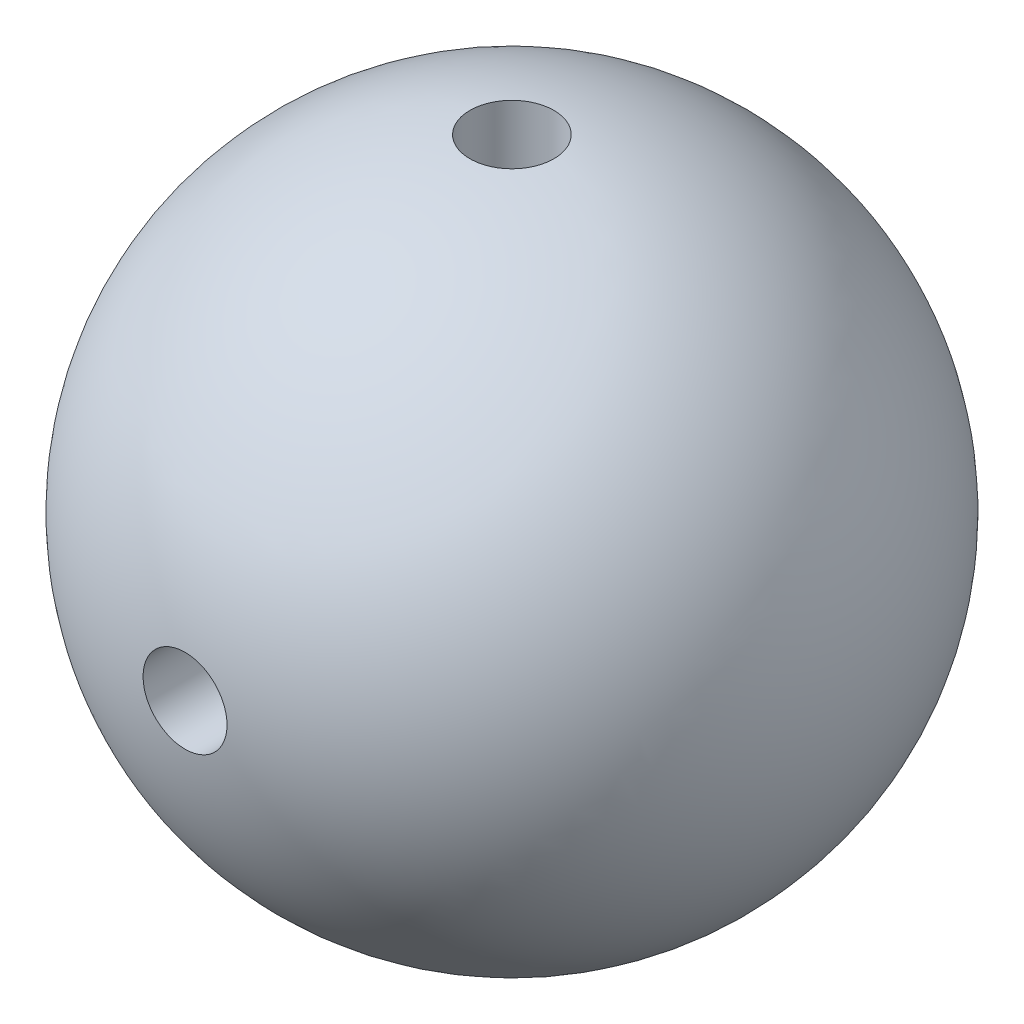
from build123d import *

# Parameters (mm, degrees)
CUT_EXTRUDE3_REACH                  = 15.597
CUT_EXTRUDE3_END_RADIUS             = 7.85
SKETCH3_R                           = 1
CUT_EXTRUDE3_DIRECTION_2_REACH      = 15.597
CUT_EXTRUDE3_DIRECTION_2_END_RADIUS = 7.85
CUT_EXTRUDE4_REACH                  = 15.597
CUT_EXTRUDE4_END_RADIUS             = 7.85
SKETCH4_R                           = 1
CUT_EXTRUDE4_DIRECTION_2_REACH      = 15.597
CUT_EXTRUDE4_DIRECTION_2_END_RADIUS = 7.85


with BuildPart() as part:
    # Sketch2 → Revolve1 (revolve)
    with BuildSketch(Plane(origin=(0, 0, 0), x_dir=(1, 0, 0), z_dir=(0, 1, 0))):
        with BuildLine():
            Line((0, 7.85), (0, -7.85))
            ThreePointArc((0, -7.85), (7.85, 0), (0, 7.85))
        make_face()
    revolve(axis=Axis((0, 0, -7.85), (0, 0, 1)))

    # Cut-Extrude3: up to this sphere (the profile starts inside it)
    cut_extrude3_end = Location((0, 0, 0)) * Sphere(CUT_EXTRUDE3_END_RADIUS, mode=Mode.PRIVATE)
    # Sketch3 → Cut-Extrude3 (cut, up to the surface)
    with BuildSketch(Plane(origin=(0, 0, 0), x_dir=(1, 0, 0), z_dir=(0, 1, 0)), mode=Mode.PRIVATE) as cut_extrude3_sk1:
        with Locations(Location((0, 0, 0), (0, 0, 90))):
            Circle(SKETCH3_R)
    cut_extrude3_tool1 = extrude(cut_extrude3_sk1.sketch, amount=-CUT_EXTRUDE3_REACH, mode=Mode.PRIVATE) & cut_extrude3_end
    add(cut_extrude3_tool1.solids().sort_by_distance((0, 0, 0))[0], mode=Mode.SUBTRACT)

    # Cut-Extrude3 direction 2: up to this sphere (the profile starts inside it)
    cut_extrude3_direction_2_end = Location((0, 0, 0)) * Sphere(CUT_EXTRUDE3_DIRECTION_2_END_RADIUS, mode=Mode.PRIVATE)
    # Sketch3 → Cut-Extrude3 direction 2 (cut, up to the surface)
    with BuildSketch(Plane(origin=(0, 0, 0), x_dir=(1, 0, 0), z_dir=(0, 1, 0)), mode=Mode.PRIVATE) as cut_extrude3_direction_2_sk1:
        with Locations(Location((0, 0, 0), (0, 0, 90))):
            Circle(SKETCH3_R)
    cut_extrude3_direction_2_tool1 = extrude(cut_extrude3_direction_2_sk1.sketch, amount=CUT_EXTRUDE3_DIRECTION_2_REACH, mode=Mode.PRIVATE) & cut_extrude3_direction_2_end
    add(cut_extrude3_direction_2_tool1.solids().sort_by_distance((0, 0, 0))[0], mode=Mode.SUBTRACT)

    # Cut-Extrude4: up to this sphere (the profile starts inside it)
    cut_extrude4_end = Location((0, 0, 0)) * Sphere(CUT_EXTRUDE4_END_RADIUS, mode=Mode.PRIVATE)
    # Sketch4 → Cut-Extrude4 (cut, up to the surface)
    with BuildSketch(Plane.XY, mode=Mode.PRIVATE) as cut_extrude4_sk1:
        Circle(SKETCH4_R)
    cut_extrude4_tool1 = extrude(cut_extrude4_sk1.sketch, amount=-CUT_EXTRUDE4_REACH, mode=Mode.PRIVATE) & cut_extrude4_end
    add(cut_extrude4_tool1.solids().sort_by_distance((0, 0, 0))[0], mode=Mode.SUBTRACT)

    # Cut-Extrude4 direction 2: up to this sphere (the profile starts inside it)
    cut_extrude4_direction_2_end = Location((0, 0, 0)) * Sphere(CUT_EXTRUDE4_DIRECTION_2_END_RADIUS, mode=Mode.PRIVATE)
    # Sketch4 → Cut-Extrude4 direction 2 (cut, up to the surface)
    with BuildSketch(Plane.XY, mode=Mode.PRIVATE) as cut_extrude4_direction_2_sk1:
        Circle(SKETCH4_R)
    cut_extrude4_direction_2_tool1 = extrude(cut_extrude4_direction_2_sk1.sketch, amount=CUT_EXTRUDE4_DIRECTION_2_REACH, mode=Mode.PRIVATE) & cut_extrude4_direction_2_end
    add(cut_extrude4_direction_2_tool1.solids().sort_by_distance((0, 0, 0))[0], mode=Mode.SUBTRACT)


solid = part.part
